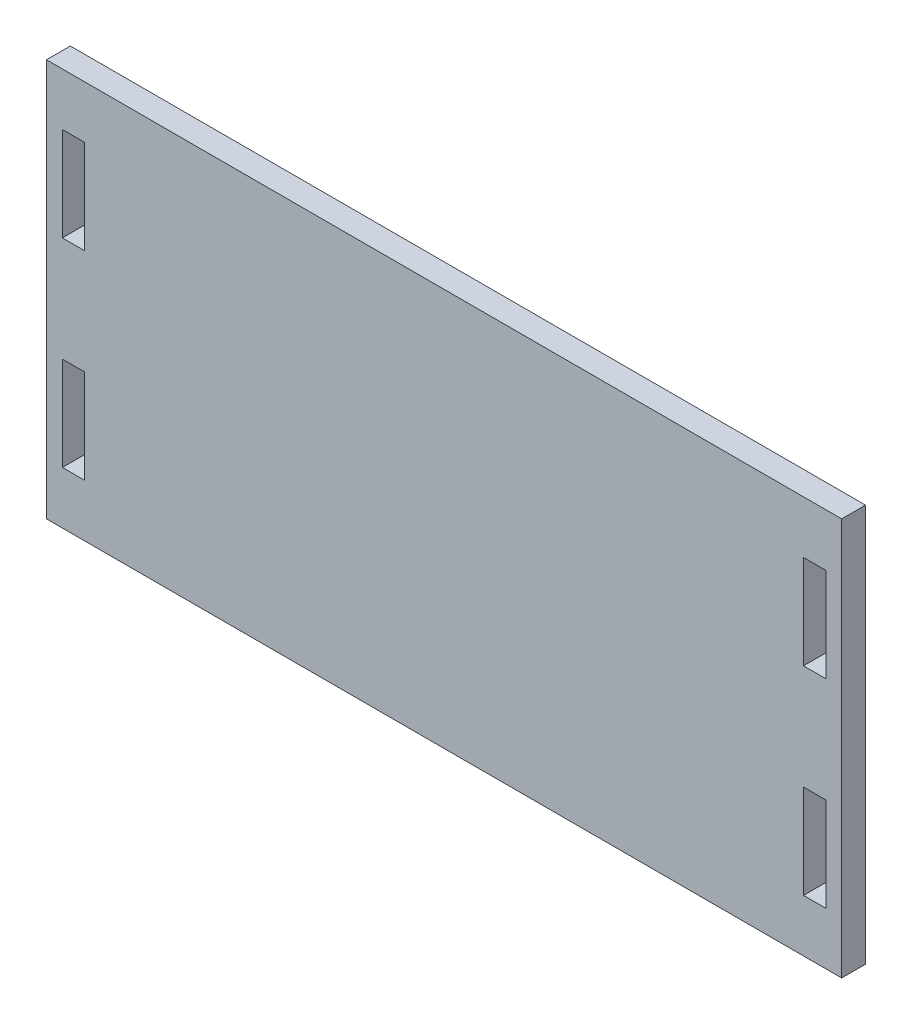
from build123d import *

# Parameters (mm, degrees)
SKETCH_1_W      = 100
SKETCH_1_H      = 50
SKETCH_1_W_2    = 2.8
SKETCH_1_H_2    = 11.8
EXTRUDE_1_DEPTH = 3


with BuildPart() as part:
    # Эскиз1 → Бобышка-Вытянуть1 (new body)
    with BuildSketch(Plane.XY):
        with Locations((50, 25)):
            Rectangle(SKETCH_1_W, SKETCH_1_H)
        with Locations((3.4, 37.5)):
            Rectangle(SKETCH_1_W_2, SKETCH_1_H_2, mode=Mode.SUBTRACT)
        with Locations((3.4, 12.5)):
            Rectangle(SKETCH_1_W_2, SKETCH_1_H_2, mode=Mode.SUBTRACT)
        with Locations((96.6, 12.5)):
            Rectangle(SKETCH_1_W_2, SKETCH_1_H_2, mode=Mode.SUBTRACT)
        with Locations((96.6, 37.5)):
            Rectangle(SKETCH_1_W_2, SKETCH_1_H_2, mode=Mode.SUBTRACT)
    extrude(amount=-EXTRUDE_1_DEPTH)


solid = part.part
